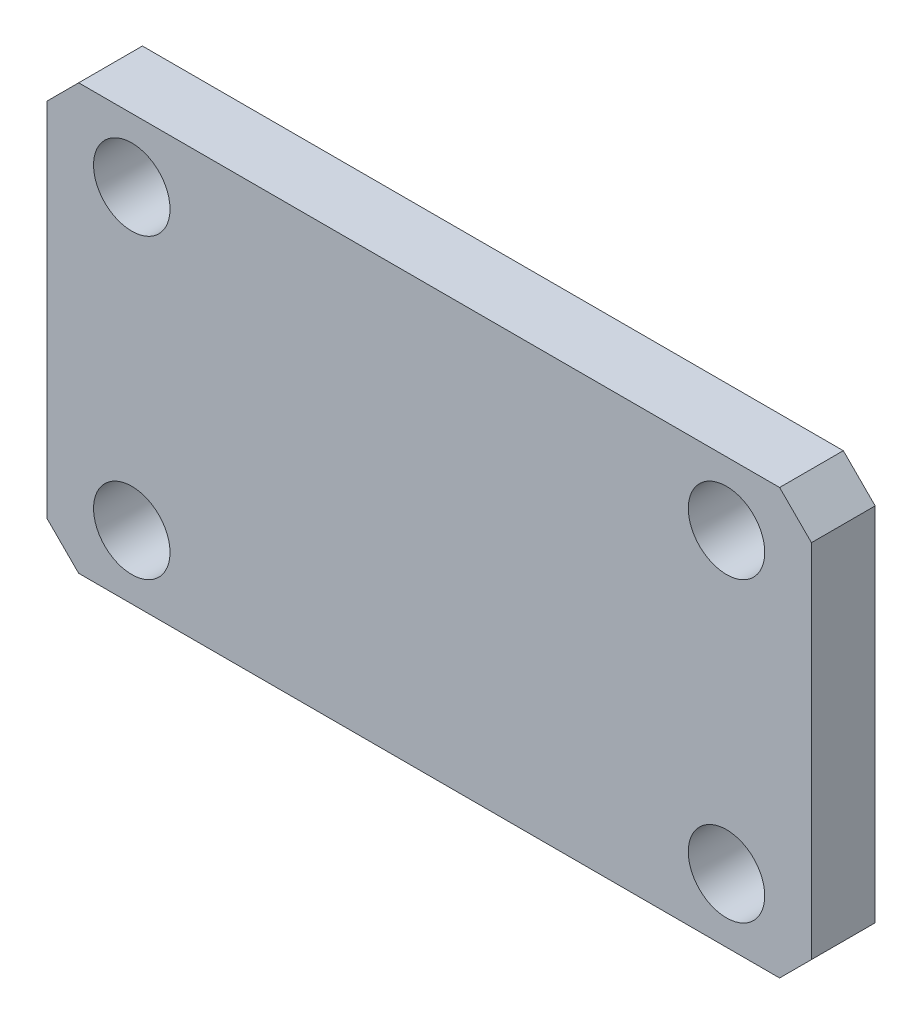
from build123d import *

# Parameters (mm, degrees)
SKETCH1_W                = 36
SKETCH1_H                = 20
BOSS_EXTRUDE1_DEPTH      = 3
M3_CLEARANCE_HOLE1_D     = 3.6
M3_CLEARANCE_HOLE1_DEPTH = 10
M3_CLEARANCE_HOLE1_TIP   = 1.081549114
CHAMFER1_SIZE            = 1.5
SKETCH4_W                = 20
SKETCH4_H                = 12
CUT_EXTRUDE1_DEPTH       = 0.5
SKETCH5_W                = 18
SKETCH5_H                = 10
BOSS_EXTRUDE2_DEPTH      = 1


with BuildPart() as part:
    # Sketch1 → Boss-Extrude1 (new body)
    with BuildSketch(Plane.XY):
        with Locations((18, 10)):
            Rectangle(SKETCH1_W, SKETCH1_H)
    extrude(amount=BOSS_EXTRUDE1_DEPTH)

    # M3 Clearance Hole1
    with Locations(Plane.XY.offset(3)):
        with Locations((4, 17), (32, 17), (32, 3), (4, 3)):
            Hole(M3_CLEARANCE_HOLE1_D / 2, depth=M3_CLEARANCE_HOLE1_DEPTH)
            with Locations((0, 0, -(M3_CLEARANCE_HOLE1_DEPTH + M3_CLEARANCE_HOLE1_TIP / 2))):  # 118° drill point
                Cone(0, M3_CLEARANCE_HOLE1_D / 2, M3_CLEARANCE_HOLE1_TIP, mode=Mode.SUBTRACT)

    # Chamfer1
    chamfer1_edges = [part.edges().sort_by_distance(p)[0] for p in [
        (0, 20, 1.5),
        (36, 20, 1.5),
        (36, 0, 1.5),
        (0, 0, 1.5),
    ]]
    chamfer(chamfer1_edges, length=CHAMFER1_SIZE)

    # Sketch4 → Cut-Extrude1 (cut)
    with BuildSketch(Plane.XY):
        with Locations((18, 10)):
            Rectangle(SKETCH4_W, SKETCH4_H)
    extrude(amount=CUT_EXTRUDE1_DEPTH, mode=Mode.SUBTRACT)


with BuildPart() as body_2:
    # Sketch5 → Boss-Extrude2 (new body)
    with BuildSketch(Plane(origin=(0, 0, 0.5), x_dir=(-1, 0, 0), z_dir=(0, 0, -1))):
        with Locations((-18, 10)):
            Rectangle(SKETCH5_W, SKETCH5_H)
    extrude(amount=BOSS_EXTRUDE2_DEPTH)


solid = Compound([part.part, body_2.part])
